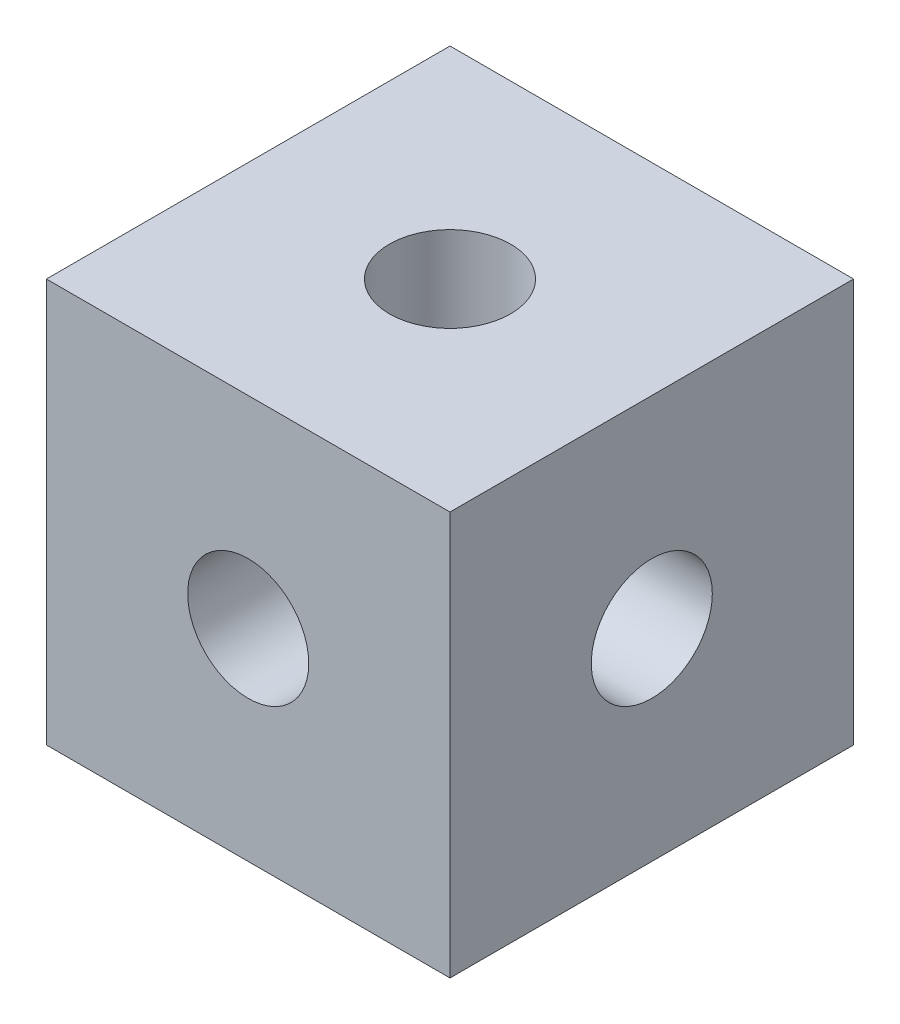
from build123d import *

# Parameters (mm, degrees)
SKETCH_1_W          = 10
SKETCH_1_H          = 10
EXTRUDE_1_DEPTH     = 10
SKETCH_2_R          = 1.5
CUT_EXTRUDE_1_DEPTH = 10
SKETCH_3_R          = 1.5
CUT_EXTRUDE_2_DEPTH = 10
SKETCH_4_R          = 1.5
CUT_EXTRUDE_3_DEPTH = 10


with BuildPart() as part:
    # 草图1 → 凸台-拉伸1 (new body)
    with BuildSketch(Plane.XY):
        with Locations((5, 5)):
            Rectangle(SKETCH_1_W, SKETCH_1_H)
    extrude(amount=EXTRUDE_1_DEPTH)

    # 草图2 → 切除-拉伸1 (cut)
    with BuildSketch(Plane(origin=(0, 10, 0), x_dir=(1, 0, 0), z_dir=(0, 1, 0))):
        with Locations(Location((5, -5, 0), (0, 0, 270))):
            Circle(SKETCH_2_R)
    extrude(amount=-CUT_EXTRUDE_1_DEPTH, mode=Mode.SUBTRACT)

    # 草图3 → 切除-拉伸2 (cut)
    with BuildSketch(Plane(origin=(10, 0, 0), x_dir=(0, 0, -1), z_dir=(1, 0, 0))):
        with Locations((-5, 5)):
            Circle(SKETCH_3_R)
    extrude(amount=-CUT_EXTRUDE_2_DEPTH, mode=Mode.SUBTRACT)

    # 草图4 → 切除-拉伸3 (cut)
    with BuildSketch(Plane.XY.offset(10)):
        with Locations((5, 5)):
            Circle(SKETCH_4_R)
    extrude(amount=-CUT_EXTRUDE_3_DEPTH, mode=Mode.SUBTRACT)


solid = part.part
